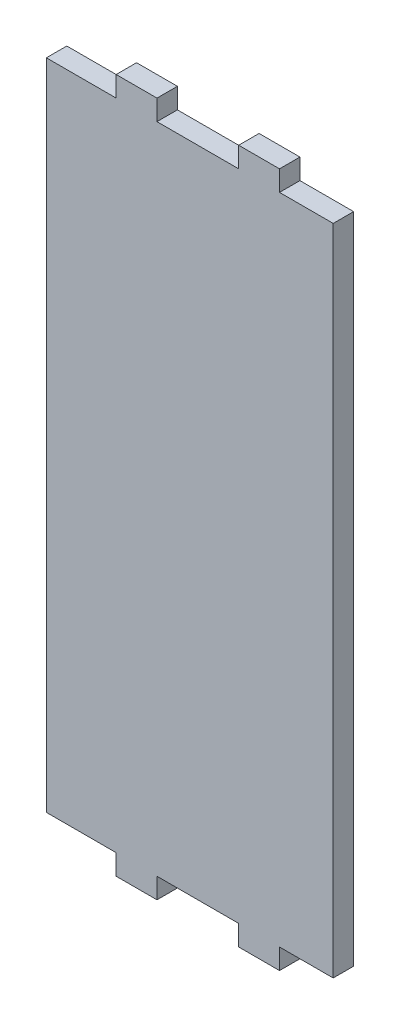
from build123d import *

# Parameters (mm, degrees)
BOSS_EXTRUDE1_DEPTH = 5


with BuildPart() as part:
    # Sketch1 → Boss-Extrude1 (new body)
    with BuildSketch(Plane.XY):
        Polygon((-176.476710021, 160), (-176.476710021, 0), (-159.395039413, 0), (-159.395039413, -5), (-149.395039413, -5), (-149.395039413, 0), (-129.395039413, 0), (-129.395039413, -5), (-119.395039413, -5), (-119.395039413, 0), (-106.249875022, 0), (-106.249875022, 160), (-119.395039413, 160), (-119.395039413, 165), (-129.395039413, 165), (-129.395039413, 160), (-149.395039413, 160), (-149.395039413, 165), (-159.395039413, 165), (-159.395039413, 160), align=None)
    extrude(amount=BOSS_EXTRUDE1_DEPTH)


solid = part.part
